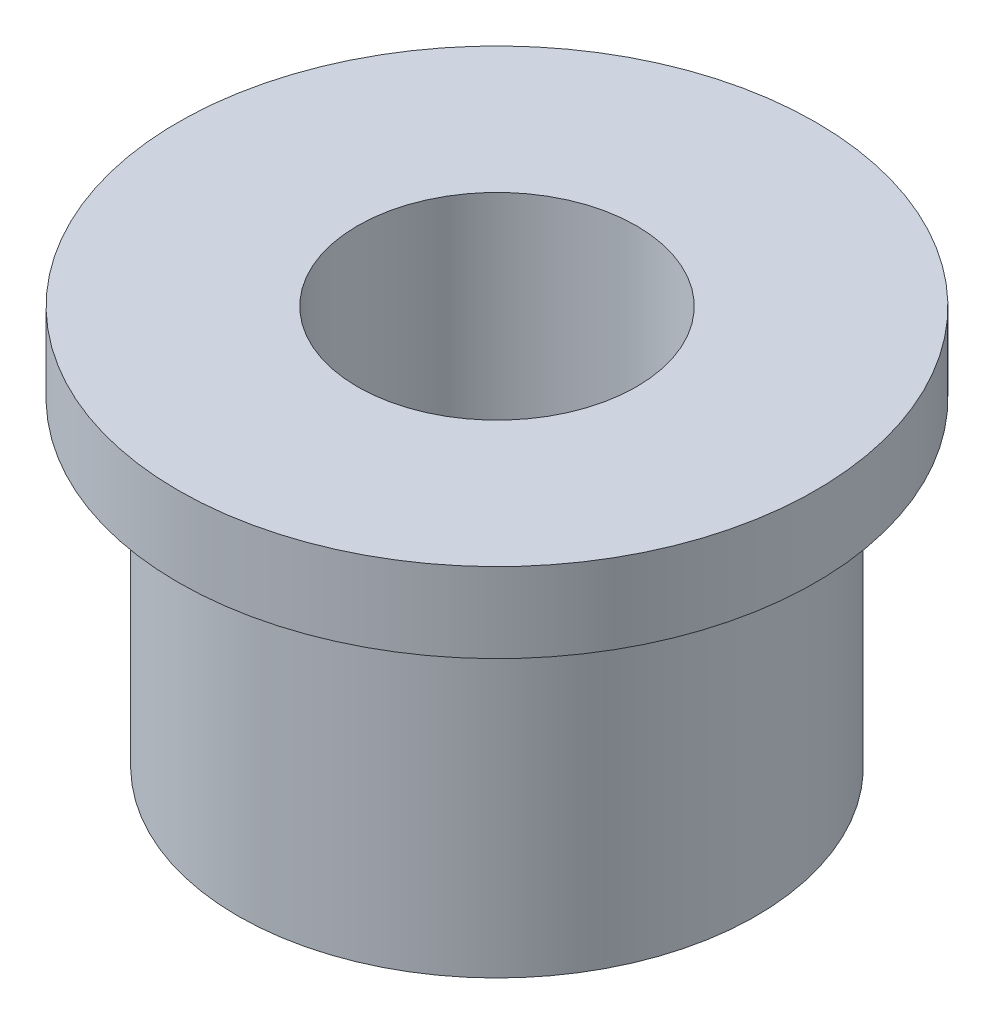
from build123d import *


with BuildPart() as part:
    # Sketch1 → Revolve1 (revolve)
    with BuildSketch(Plane.XY, mode=Mode.PRIVATE) as revolve1_sk:
        Polygon((6.5, 0), (6.5, 8), (8, 8), (8, 10), (3.5, 10), (3.5, 2), align=None)
    revolve(revolve1_sk.sketch.rotate(Axis((0, 8.947963801, 0), (0, -1, 0)), 90), axis=Axis((0, 8.947963801, 0), (0, -1, 0)))


solid = part.part
